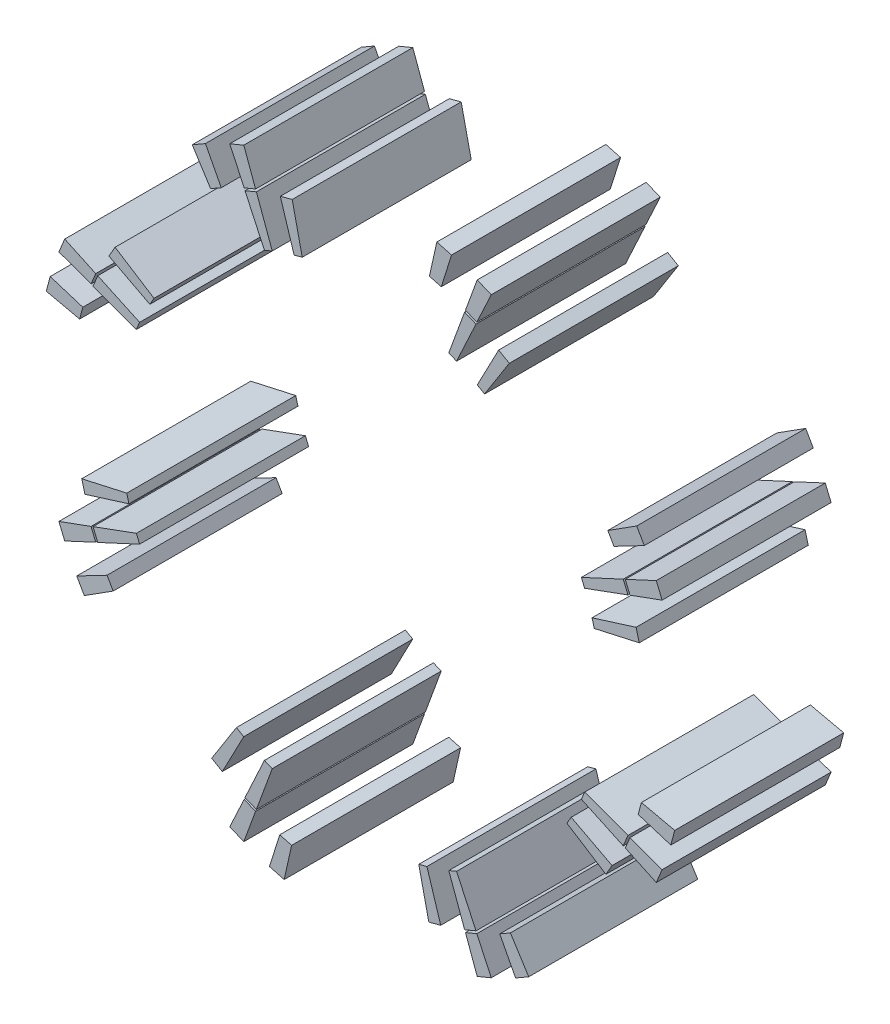
from build123d import *

# Parameters (mm, degrees)
SLOT_COPPER_ENVELOPES_START    = -15
SLOT_COPPER_ENVELOPES_DEPTH    = 30
SLOT_COPPER_ENVELOPES_2_DEPTH  = 30
SLOT_COPPER_ENVELOPES_3_DEPTH  = 30
SLOT_COPPER_ENVELOPES_4_DEPTH  = 30
SLOT_COPPER_ENVELOPES_5_DEPTH  = 30
SLOT_COPPER_ENVELOPES_6_DEPTH  = 30
SLOT_COPPER_ENVELOPES_7_DEPTH  = 30
SLOT_COPPER_ENVELOPES_8_DEPTH  = 30
SLOT_COPPER_ENVELOPES_9_DEPTH  = 30
SLOT_COPPER_ENVELOPES_10_DEPTH = 30
SLOT_COPPER_ENVELOPES_11_DEPTH = 30
SLOT_COPPER_ENVELOPES_12_DEPTH = 30
SLOT_COPPER_ENVELOPES_13_DEPTH = 30
SLOT_COPPER_ENVELOPES_14_DEPTH = 30
SLOT_COPPER_ENVELOPES_15_DEPTH = 30
SLOT_COPPER_ENVELOPES_16_DEPTH = 30
SLOT_COPPER_ENVELOPES_17_DEPTH = 30
SLOT_COPPER_ENVELOPES_18_DEPTH = 30
SLOT_COPPER_ENVELOPES_19_DEPTH = 30
SLOT_COPPER_ENVELOPES_20_DEPTH = 30
SLOT_COPPER_ENVELOPES_21_DEPTH = 30
SLOT_COPPER_ENVELOPES_22_DEPTH = 30
SLOT_COPPER_ENVELOPES_23_DEPTH = 30
SLOT_COPPER_ENVELOPES_24_DEPTH = 30
SLOT_COPPER_ENVELOPES_25_DEPTH = 30
SLOT_COPPER_ENVELOPES_26_DEPTH = 30
SLOT_COPPER_ENVELOPES_27_DEPTH = 30
SLOT_COPPER_ENVELOPES_28_DEPTH = 30
SLOT_COPPER_ENVELOPES_29_DEPTH = 30
SLOT_COPPER_ENVELOPES_30_DEPTH = 30
SLOT_COPPER_ENVELOPES_31_DEPTH = 30
SLOT_COPPER_ENVELOPES_32_DEPTH = 30


with BuildPart() as part:
    # Эскиз1 → Slot_copper_envelopes (new body)
    with BuildSketch(Plane.XY.offset(SLOT_COPPER_ENVELOPES_START)):
        Polygon((41.492235107, 10.341353754), (49.485358891, 12.129228595), (48.920192212, 14.238459354), (41.104006539, 11.790242493), align=None)
    extrude(amount=SLOT_COPPER_ENVELOPES_DEPTH)


with BuildPart() as body_2:
    # Эскиз1 → Slot_copper_envelopes 2 (new body)
    with BuildSketch(Plane.XY.offset(SLOT_COPPER_ENVELOPES_START)):
        Polygon((47.83764723, 18.633226791), (53.540201034, 20.71584793), (52.506955767, 23.210322668), (47.002005771, 20.650643733), align=None)
    extrude(amount=SLOT_COPPER_ENVELOPES_2_DEPTH)


with BuildPart() as body_3:
    # Эскиз1 → Slot_copper_envelopes 3 (new body)
    with BuildSketch(Plane.XY.offset(SLOT_COPPER_ENVELOPES_START)):
        Polygon((39.787445755, 15.668705494), (47.478822762, 18.48459683), (46.643181304, 20.502013772), (39.213420607, 17.054524793), align=None)
    extrude(amount=SLOT_COPPER_ENVELOPES_3_DEPTH)


with BuildPart() as body_4:
    # Эскиз1 → Slot_copper_envelopes 4 (new body)
    with BuildSketch(Plane.XY.offset(SLOT_COPPER_ENVELOPES_START)):
        Polygon((44.996265385, 24.71788289), (50.378196443, 27.527019551), (49.028196443, 29.865288141), (43.904447203, 26.608967454), align=None)
    extrude(amount=SLOT_COPPER_ENVELOPES_4_DEPTH)


with BuildPart() as body_5:
    # Эскиз1 → Slot_copper_envelopes 5 (new body)
    with BuildSketch(Plane.XY.offset(SLOT_COPPER_ENVELOPES_START)):
        Polygon((22.026999445, 36.651882176), (26.414773051, 43.568092631), (24.523688487, 44.659910813), (20.727961339, 37.401882176), align=None)
    extrude(amount=SLOT_COPPER_ENVELOPES_5_DEPTH)


with BuildPart() as body_6:
    # Эскиз1 → Slot_copper_envelopes 6 (new body)
    with BuildSketch(Plane.XY.offset(SLOT_COPPER_ENVELOPES_START)):
        Polygon((20.650643733, 47.002005771), (23.210322668, 52.506955767), (20.71584793, 53.540201034), (18.633226791, 47.83764723), align=None)
    extrude(amount=SLOT_COPPER_ENVELOPES_6_DEPTH)


with BuildPart() as body_7:
    # Эскиз1 → Slot_copper_envelopes 7 (new body)
    with BuildSketch(Plane.XY.offset(SLOT_COPPER_ENVELOPES_START)):
        Polygon((17.054524793, 39.213420607), (20.502013772, 46.643181304), (18.48459683, 47.478822762), (15.668705494, 39.787445755), align=None)
    extrude(amount=SLOT_COPPER_ENVELOPES_7_DEPTH)


with BuildPart() as body_8:
    # Эскиз1 → Slot_copper_envelopes 8 (new body)
    with BuildSketch(Plane.XY.offset(SLOT_COPPER_ENVELOPES_START)):
        Polygon((14.338981773, 49.29534699), (16.158222139, 55.087306519), (13.550222408, 55.786117941), (12.229751015, 49.860513668), align=None)
    extrude(amount=SLOT_COPPER_ENVELOPES_8_DEPTH)


with BuildPart() as body_9:
    # Эскиз1 → Slot_copper_envelopes 9 (new body)
    with BuildSketch(Plane.XY.offset(SLOT_COPPER_ENVELOPES_START)):
        Polygon((-10.341353754, 41.492235107), (-12.129228595, 49.485358891), (-14.238459354, 48.920192212), (-11.790242493, 41.104006539), align=None)
    extrude(amount=SLOT_COPPER_ENVELOPES_9_DEPTH)


with BuildPart() as body_10:
    # Эскиз1 → Slot_copper_envelopes 10 (new body)
    with BuildSketch(Plane.XY.offset(SLOT_COPPER_ENVELOPES_START)):
        Polygon((-18.633226791, 47.83764723), (-20.71584793, 53.540201034), (-23.210322668, 52.506955767), (-20.650643733, 47.002005771), align=None)
    extrude(amount=SLOT_COPPER_ENVELOPES_10_DEPTH)


with BuildPart() as body_11:
    # Эскиз1 → Slot_copper_envelopes 11 (new body)
    with BuildSketch(Plane.XY.offset(SLOT_COPPER_ENVELOPES_START)):
        Polygon((-15.668705494, 39.787445755), (-18.48459683, 47.478822762), (-20.502013772, 46.643181304), (-17.054524793, 39.213420607), align=None)
    extrude(amount=SLOT_COPPER_ENVELOPES_11_DEPTH)


with BuildPart() as body_12:
    # Эскиз1 → Slot_copper_envelopes 12 (new body)
    with BuildSketch(Plane.XY.offset(SLOT_COPPER_ENVELOPES_START)):
        Polygon((-24.71788289, 44.996265385), (-27.527019551, 50.378196443), (-29.865288141, 49.028196443), (-26.608967454, 43.904447203), align=None)
    extrude(amount=SLOT_COPPER_ENVELOPES_12_DEPTH)


with BuildPart() as body_13:
    # Эскиз1 → Slot_copper_envelopes 13 (new body)
    with BuildSketch(Plane.XY.offset(SLOT_COPPER_ENVELOPES_START)):
        Polygon((-36.651882176, 22.026999445), (-43.568092631, 26.414773051), (-44.659910813, 24.523688487), (-37.401882176, 20.727961339), align=None)
    extrude(amount=SLOT_COPPER_ENVELOPES_13_DEPTH)


with BuildPart() as body_14:
    # Эскиз1 → Slot_copper_envelopes 14 (new body)
    with BuildSketch(Plane.XY.offset(SLOT_COPPER_ENVELOPES_START)):
        Polygon((-47.002005771, 20.650643733), (-52.506955767, 23.210322668), (-53.540201034, 20.71584793), (-47.83764723, 18.633226791), align=None)
    extrude(amount=SLOT_COPPER_ENVELOPES_14_DEPTH)


with BuildPart() as body_15:
    # Эскиз1 → Slot_copper_envelopes 15 (new body)
    with BuildSketch(Plane.XY.offset(SLOT_COPPER_ENVELOPES_START)):
        Polygon((-39.213420607, 17.054524793), (-46.643181304, 20.502013772), (-47.478822762, 18.48459683), (-39.787445755, 15.668705494), align=None)
    extrude(amount=SLOT_COPPER_ENVELOPES_15_DEPTH)


with BuildPart() as body_16:
    # Эскиз1 → Slot_copper_envelopes 16 (new body)
    with BuildSketch(Plane.XY.offset(SLOT_COPPER_ENVELOPES_START)):
        Polygon((-49.29534699, 14.338981773), (-55.087306519, 16.158222139), (-55.786117941, 13.550222408), (-49.860513668, 12.229751015), align=None)
    extrude(amount=SLOT_COPPER_ENVELOPES_16_DEPTH)


with BuildPart() as body_17:
    # Эскиз1 → Slot_copper_envelopes 17 (new body)
    with BuildSketch(Plane.XY.offset(SLOT_COPPER_ENVELOPES_START)):
        Polygon((-41.492235107, -10.341353754), (-49.485358891, -12.129228595), (-48.920192212, -14.238459354), (-41.104006539, -11.790242493), align=None)
    extrude(amount=SLOT_COPPER_ENVELOPES_17_DEPTH)


with BuildPart() as body_18:
    # Эскиз1 → Slot_copper_envelopes 18 (new body)
    with BuildSketch(Plane.XY.offset(SLOT_COPPER_ENVELOPES_START)):
        Polygon((-47.83764723, -18.633226791), (-53.540201034, -20.71584793), (-52.506955767, -23.210322668), (-47.002005771, -20.650643733), align=None)
    extrude(amount=SLOT_COPPER_ENVELOPES_18_DEPTH)


with BuildPart() as body_19:
    # Эскиз1 → Slot_copper_envelopes 19 (new body)
    with BuildSketch(Plane.XY.offset(SLOT_COPPER_ENVELOPES_START)):
        Polygon((-39.787445755, -15.668705494), (-47.478822762, -18.48459683), (-46.643181304, -20.502013772), (-39.213420607, -17.054524793), align=None)
    extrude(amount=SLOT_COPPER_ENVELOPES_19_DEPTH)


with BuildPart() as body_20:
    # Эскиз1 → Slot_copper_envelopes 20 (new body)
    with BuildSketch(Plane.XY.offset(SLOT_COPPER_ENVELOPES_START)):
        Polygon((-44.996265385, -24.71788289), (-50.378196443, -27.527019551), (-49.028196443, -29.865288141), (-43.904447203, -26.608967454), align=None)
    extrude(amount=SLOT_COPPER_ENVELOPES_20_DEPTH)


with BuildPart() as body_21:
    # Эскиз1 → Slot_copper_envelopes 21 (new body)
    with BuildSketch(Plane.XY.offset(SLOT_COPPER_ENVELOPES_START)):
        Polygon((-22.026999445, -36.651882176), (-26.414773051, -43.568092631), (-24.523688487, -44.659910813), (-20.727961339, -37.401882176), align=None)
    extrude(amount=SLOT_COPPER_ENVELOPES_21_DEPTH)


with BuildPart() as body_22:
    # Эскиз1 → Slot_copper_envelopes 22 (new body)
    with BuildSketch(Plane.XY.offset(SLOT_COPPER_ENVELOPES_START)):
        Polygon((-20.650643733, -47.002005771), (-23.210322668, -52.506955767), (-20.71584793, -53.540201034), (-18.633226791, -47.83764723), align=None)
    extrude(amount=SLOT_COPPER_ENVELOPES_22_DEPTH)


with BuildPart() as body_23:
    # Эскиз1 → Slot_copper_envelopes 23 (new body)
    with BuildSketch(Plane.XY.offset(SLOT_COPPER_ENVELOPES_START)):
        Polygon((-17.054524793, -39.213420607), (-20.502013772, -46.643181304), (-18.48459683, -47.478822762), (-15.668705494, -39.787445755), align=None)
    extrude(amount=SLOT_COPPER_ENVELOPES_23_DEPTH)


with BuildPart() as body_24:
    # Эскиз1 → Slot_copper_envelopes 24 (new body)
    with BuildSketch(Plane.XY.offset(SLOT_COPPER_ENVELOPES_START)):
        Polygon((-14.338981773, -49.29534699), (-16.158222139, -55.087306519), (-13.550222408, -55.786117941), (-12.229751015, -49.860513668), align=None)
    extrude(amount=SLOT_COPPER_ENVELOPES_24_DEPTH)


with BuildPart() as body_25:
    # Эскиз1 → Slot_copper_envelopes 25 (new body)
    with BuildSketch(Plane.XY.offset(SLOT_COPPER_ENVELOPES_START)):
        Polygon((10.341353754, -41.492235107), (12.129228595, -49.485358891), (14.238459354, -48.920192212), (11.790242493, -41.104006539), align=None)
    extrude(amount=SLOT_COPPER_ENVELOPES_25_DEPTH)


with BuildPart() as body_26:
    # Эскиз1 → Slot_copper_envelopes 26 (new body)
    with BuildSketch(Plane.XY.offset(SLOT_COPPER_ENVELOPES_START)):
        Polygon((18.633226791, -47.83764723), (20.71584793, -53.540201034), (23.210322668, -52.506955767), (20.650643733, -47.002005771), align=None)
    extrude(amount=SLOT_COPPER_ENVELOPES_26_DEPTH)


with BuildPart() as body_27:
    # Эскиз1 → Slot_copper_envelopes 27 (new body)
    with BuildSketch(Plane.XY.offset(SLOT_COPPER_ENVELOPES_START)):
        Polygon((15.668705494, -39.787445755), (18.48459683, -47.478822762), (20.502013772, -46.643181304), (17.054524793, -39.213420607), align=None)
    extrude(amount=SLOT_COPPER_ENVELOPES_27_DEPTH)


with BuildPart() as body_28:
    # Эскиз1 → Slot_copper_envelopes 28 (new body)
    with BuildSketch(Plane.XY.offset(SLOT_COPPER_ENVELOPES_START)):
        Polygon((24.71788289, -44.996265385), (27.527019551, -50.378196443), (29.865288141, -49.028196443), (26.608967454, -43.904447203), align=None)
    extrude(amount=SLOT_COPPER_ENVELOPES_28_DEPTH)


with BuildPart() as body_29:
    # Эскиз1 → Slot_copper_envelopes 29 (new body)
    with BuildSketch(Plane.XY.offset(SLOT_COPPER_ENVELOPES_START)):
        Polygon((36.651882176, -22.026999445), (43.568092631, -26.414773051), (44.659910813, -24.523688487), (37.401882176, -20.727961339), align=None)
    extrude(amount=SLOT_COPPER_ENVELOPES_29_DEPTH)


with BuildPart() as body_30:
    # Эскиз1 → Slot_copper_envelopes 30 (new body)
    with BuildSketch(Plane.XY.offset(SLOT_COPPER_ENVELOPES_START)):
        Polygon((47.002005771, -20.650643733), (52.506955767, -23.210322668), (53.540201034, -20.71584793), (47.83764723, -18.633226791), align=None)
    extrude(amount=SLOT_COPPER_ENVELOPES_30_DEPTH)


with BuildPart() as body_31:
    # Эскиз1 → Slot_copper_envelopes 31 (new body)
    with BuildSketch(Plane.XY.offset(SLOT_COPPER_ENVELOPES_START)):
        Polygon((39.213420607, -17.054524793), (46.643181304, -20.502013772), (47.478822762, -18.48459683), (39.787445755, -15.668705494), align=None)
    extrude(amount=SLOT_COPPER_ENVELOPES_31_DEPTH)


with BuildPart() as body_32:
    # Эскиз1 → Slot_copper_envelopes 32 (new body)
    with BuildSketch(Plane.XY.offset(SLOT_COPPER_ENVELOPES_START)):
        Polygon((49.29534699, -14.338981773), (55.087306519, -16.158222139), (55.786117941, -13.550222408), (49.860513668, -12.229751015), align=None)
    extrude(amount=SLOT_COPPER_ENVELOPES_32_DEPTH)


solid = Compound([part.part, body_2.part, body_3.part, body_4.part, body_5.part, body_6.part, body_7.part, body_8.part, body_9.part, body_10.part, body_11.part, body_12.part, body_13.part, body_14.part, body_15.part, body_16.part, body_17.part, body_18.part, body_19.part, body_20.part, body_21.part, body_22.part, body_23.part, body_24.part, body_25.part, body_26.part, body_27.part, body_28.part, body_29.part, body_30.part, body_31.part, body_32.part])
